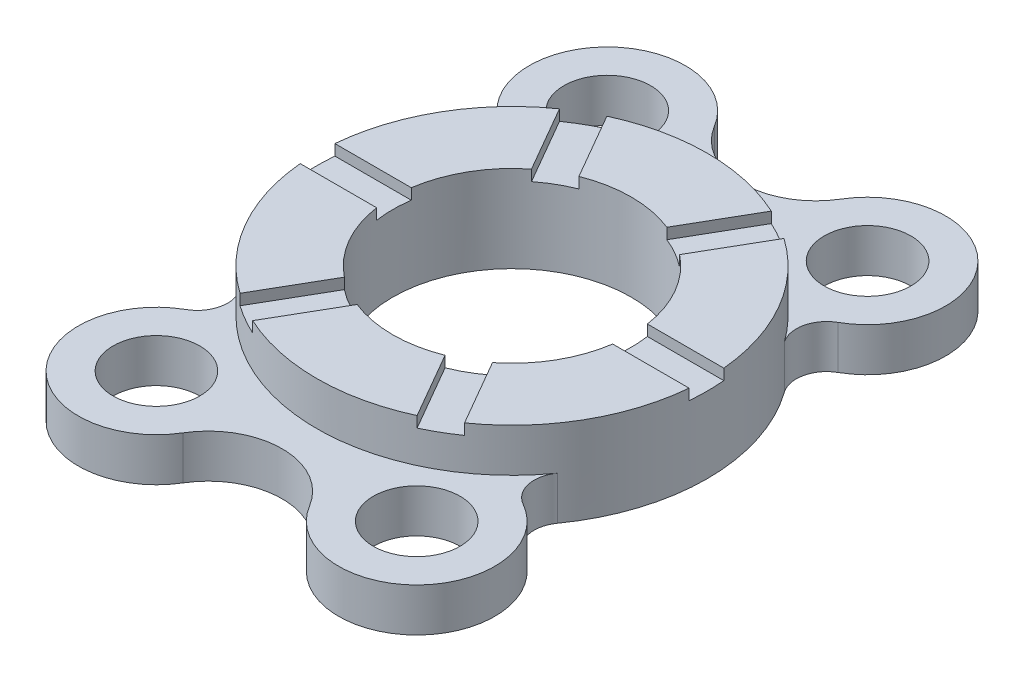
from build123d import *

# Parameters (mm, degrees)
SKETCH_1_R               = 27.5
SKETCH_1_R_2             = 10
EXTRUDE_1_DEPTH          = 10
SKETCH_2_R               = 27.5
EXTRUDE_2_DEPTH          = 10
SKETCH_3_W               = 8
SKETCH_3_H               = 2.5
CUT_EXTRUDE_2_DEPTH      = 108
PATTERN_CIRCULAR_2_COUNT = 6


with BuildPart() as part:
    # Эскиз1 → Бобышка-Вытянуть1 (new body)
    with BuildSketch(Plane(origin=(0, 0, 0), x_dir=(1, 0, 0), z_dir=(0, 1, 0))):
        with BuildLine():
            ThreePointArc((36.626693786, -26.14355183), (45, 0), (36.626693786, 26.14355183))
            ThreePointArc((36.626693786, 26.14355183), (35.489388485, 31.722157226), (38.87340923, 36.300661906))
            ThreePointArc((38.87340923, 36.300661906), (42.889809267, 64.52547333), (14.571428571, 61.232941793))
            ThreePointArc((14.571428571, 61.232941793), (0, 52.989280604), (-14.571428571, 61.232941793))
            ThreePointArc((-14.571428571, 61.232941793), (-42.889809267, 64.52547333), (-38.87340923, 36.300661906))
            ThreePointArc((-38.87340923, 36.300661906), (-35.489388485, 31.722157226), (-36.626693786, 26.14355183))
            ThreePointArc((-36.626693786, 26.14355183), (-45, 0), (-36.626693786, -26.14355183))
            ThreePointArc((-36.626693786, -26.14355183), (-35.489388485, -31.722157226), (-38.87340923, -36.300661906))
            ThreePointArc((-38.87340923, -36.300661906), (-42.889809267, -64.52547333), (-14.571428571, -61.232941793))
            ThreePointArc((-14.571428571, -61.232941793), (0, -52.989280604), (14.571428571, -61.232941793))
            ThreePointArc((14.571428571, -61.232941793), (42.889809267, -64.52547333), (38.87340923, -36.300661906))
            ThreePointArc((38.87340923, -36.300661906), (35.489388485, -31.722157226), (36.626693786, -26.14355183))
        make_face()
        Circle(SKETCH_1_R, mode=Mode.SUBTRACT)
        with Locations((30, -51.961524227)):
            Circle(SKETCH_1_R_2, mode=Mode.SUBTRACT)
        with Locations((-30, -51.961524227)):
            Circle(SKETCH_1_R_2, mode=Mode.SUBTRACT)
        with Locations((-30, 51.961524227)):
            Circle(SKETCH_1_R_2, mode=Mode.SUBTRACT)
        with Locations((30, 51.961524227)):
            Circle(SKETCH_1_R_2, mode=Mode.SUBTRACT)
    extrude(amount=EXTRUDE_1_DEPTH)

    # Эскиз2 → Бобышка-Вытянуть2 (add)
    with BuildSketch(Plane(origin=(0, 10, 0), x_dir=(1, 0, 0), z_dir=(0, 1, 0))):
        with BuildLine():
            ThreePointArc((36.626693786, 26.14355183), (0, 45), (-36.626693786, 26.14355183))
            ThreePointArc((-36.626693786, 26.14355183), (-45, 0), (-36.626693786, -26.14355183))
            ThreePointArc((-36.626693786, -26.14355183), (0, -45), (36.626693786, -26.14355183))
            ThreePointArc((36.626693786, -26.14355183), (42.855578519, -13.725865722), (45, 0))
            ThreePointArc((45, 0), (42.855578519, 13.725865722), (36.626693786, 26.14355183))
        make_face()
        Circle(SKETCH_2_R, mode=Mode.SUBTRACT)
    extrude(amount=EXTRUDE_2_DEPTH)

    # Эскиз3 → Вырез-Вытянуть2 (cut)
    with BuildSketch(Plane(origin=(0, 0, 0), x_dir=(0, 0, -1), z_dir=(1, 0, 0))):
        with Locations((0, 18.75)):
            Rectangle(SKETCH_3_W, SKETCH_3_H)
    cut_extrude_2 = extrude(amount=-CUT_EXTRUDE_2_DEPTH, mode=Mode.SUBTRACT)

    # Круговой массив2: Вырез-Вытянуть2 ×6 about axis
    pattern_circular_2_axis = Axis((0, -50, 0), (0, 1, 0))
    for i in range(1, PATTERN_CIRCULAR_2_COUNT):
        add(cut_extrude_2.rotate(pattern_circular_2_axis, i * 360 / PATTERN_CIRCULAR_2_COUNT), mode=Mode.SUBTRACT)


solid = part.part
